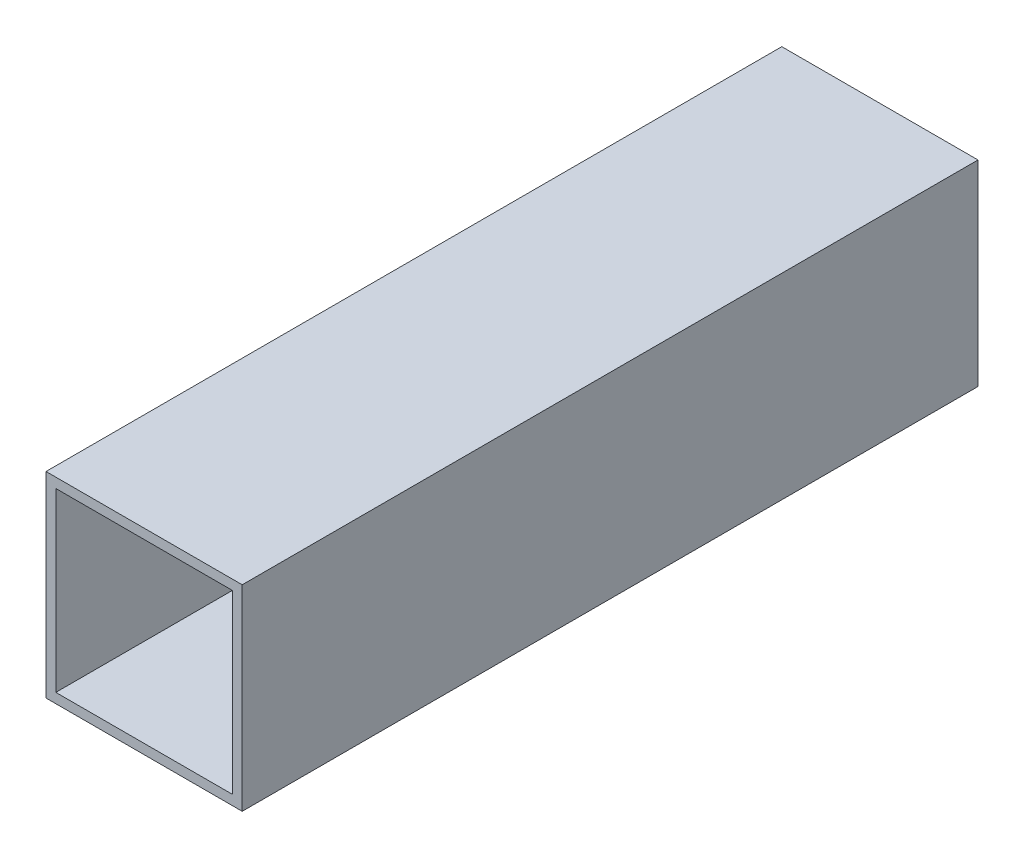
from build123d import *

# Parameters (mm, degrees)
SKETCH1_W           = 100
SKETCH1_H           = 100
SKETCH1_W_2         = 90
SKETCH1_H_2         = 90
BOSS_EXTRUDE1_DEPTH = 187.5


with BuildPart() as part:
    # Sketch1 → Boss-Extrude1 (new, symmetric)
    with BuildSketch(Plane.XY):
        Rectangle(SKETCH1_W, SKETCH1_H)
        Rectangle(SKETCH1_W_2, SKETCH1_H_2, mode=Mode.SUBTRACT)
    extrude(amount=BOSS_EXTRUDE1_DEPTH, both=True)


solid = part.part
